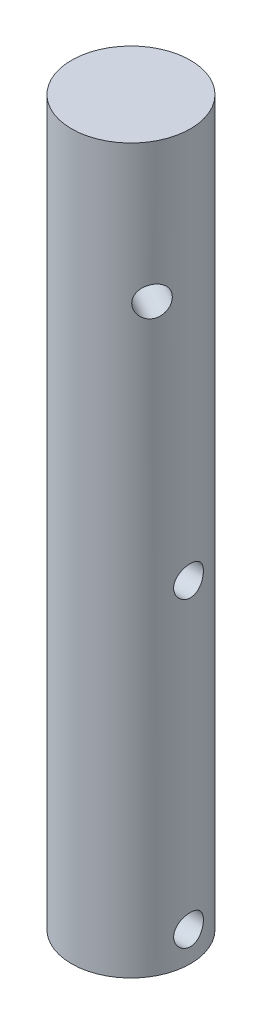
from build123d import *

# Parameters (mm, degrees)
TWELVE_MILLIMETRE_AXLE_STOCK_SKETCH_R = 6
TWELVE_MILLIMETRE_AXLE_STOCK_DEPTH    = 73
MOTOR_COUPLING_SOCKET_SKETCH_R        = 3.05
MOTOR_COUPLING_SOCKET_DEPTH           = 22.1
FRONT_COLLAR_PIN_SKETCH_R             = 1.5
FRONT_COLLAR_PIN_DEPTH                = 14
REAR_COLLAR_PIN_SKETCH_R              = 1.5
REAR_COLLAR_PIN_DEPTH                 = 14
HUB_DRIVE_PIN_SKETCH_R                = 1.5
HUB_DRIVE_PIN_DEPTH                   = 14


with BuildPart() as part:
    # Twelve millimetre axle stock sketch → Twelve millimetre axle stock (new body)
    with BuildSketch(Plane(origin=(0, -283, 0), x_dir=(1, 0, 0), z_dir=(0, 1, 0))):
        with Locations(Location((-19.009182883, 53.244882879, 0), (0, 0, 270))):
            Circle(TWELVE_MILLIMETRE_AXLE_STOCK_SKETCH_R)
    extrude(amount=TWELVE_MILLIMETRE_AXLE_STOCK_DEPTH)

    # Motor coupling socket sketch → Motor coupling socket (cut)
    with BuildSketch(Plane(origin=(0, -232, 0), x_dir=(1, 0, 0), z_dir=(0, 1, 0))):
        with Locations(Location((-19.009182883, 53.244882879, 0), (0, 0, 270))):
            Circle(MOTOR_COUPLING_SOCKET_SKETCH_R)
    extrude(amount=MOTOR_COUPLING_SOCKET_DEPTH, mode=Mode.SUBTRACT)

    # Front collar pin sketch → Front collar pin (cut)
    with BuildSketch(Plane(origin=(-26.009182883, 0, 0), x_dir=(0, 0, -1), z_dir=(1, 0, 0))):
        with Locations(Location((53.244882879, -213, 0), (0, 0, 180))):
            Circle(FRONT_COLLAR_PIN_SKETCH_R)
    extrude(amount=FRONT_COLLAR_PIN_DEPTH, mode=Mode.SUBTRACT)

    # Rear collar pin sketch → Rear collar pin (cut)
    with BuildSketch(Plane(origin=(-26.009182883, 0, 0), x_dir=(0, 0, -1), z_dir=(1, 0, 0))):
        with Locations(Location((53.244882879, -243.5, 0), (0, 0, 180))):
            Circle(REAR_COLLAR_PIN_SKETCH_R)
    extrude(amount=REAR_COLLAR_PIN_DEPTH, mode=Mode.SUBTRACT)

    # Hub drive pin sketch → Hub drive pin (cut)
    with BuildSketch(Plane(origin=(-43.374775586, 0, -25.042438361), x_dir=(0.5000000000000001, 0, -0.8660254037844386), z_dir=(0.8660254037844386, 0, 0.5000000000000001))):
        with Locations(Location((36.606829753, -269, 0), (0, 0, 180))):
            Circle(HUB_DRIVE_PIN_SKETCH_R)
    extrude(amount=HUB_DRIVE_PIN_DEPTH, mode=Mode.SUBTRACT)


with BuildPart() as body_2:
    # Mirror1: mirrored copy
    add(part.part.mirror(Plane(origin=(0, 0, 0), x_dir=(0, 0, 1), z_dir=(0, -1, 0))))


solid = body_2.part
